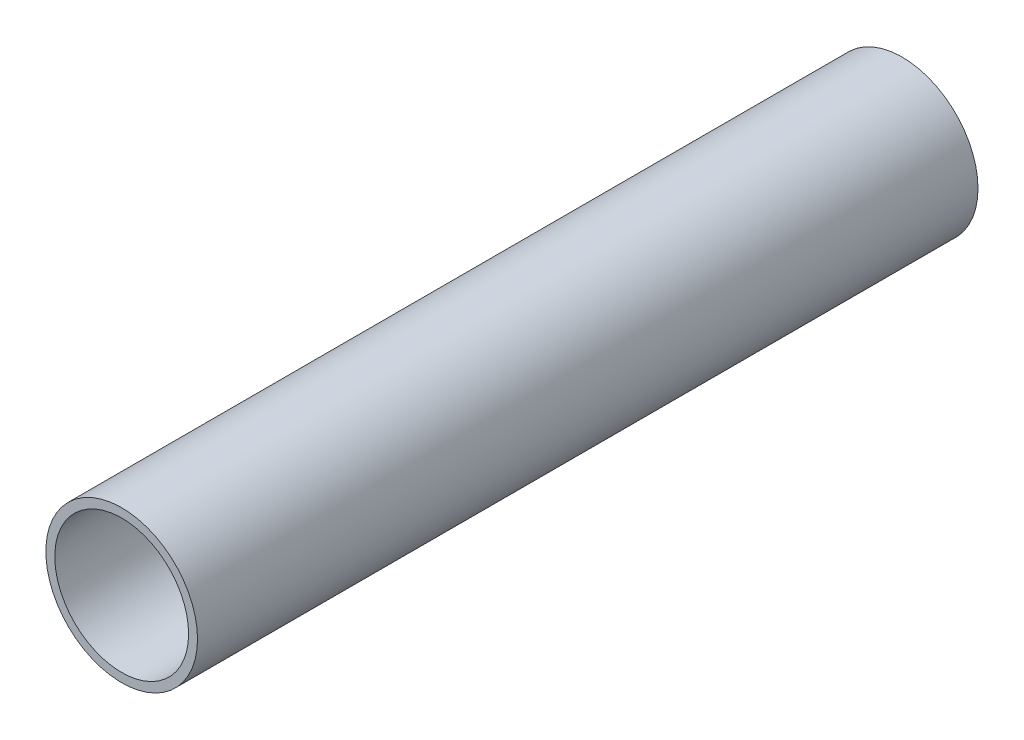
from build123d import *

# Parameters (mm, degrees)
SKETCH1_R           = 17
SKETCH1_R_2         = 15
BOSS_EXTRUDE1_DEPTH = 87.5


with BuildPart() as part:
    # Sketch1 → Boss-Extrude1 (new, symmetric)
    with BuildSketch(Plane.XY):
        Circle(SKETCH1_R)
        Circle(SKETCH1_R_2, mode=Mode.SUBTRACT)
    extrude(amount=BOSS_EXTRUDE1_DEPTH, both=True)


solid = part.part
